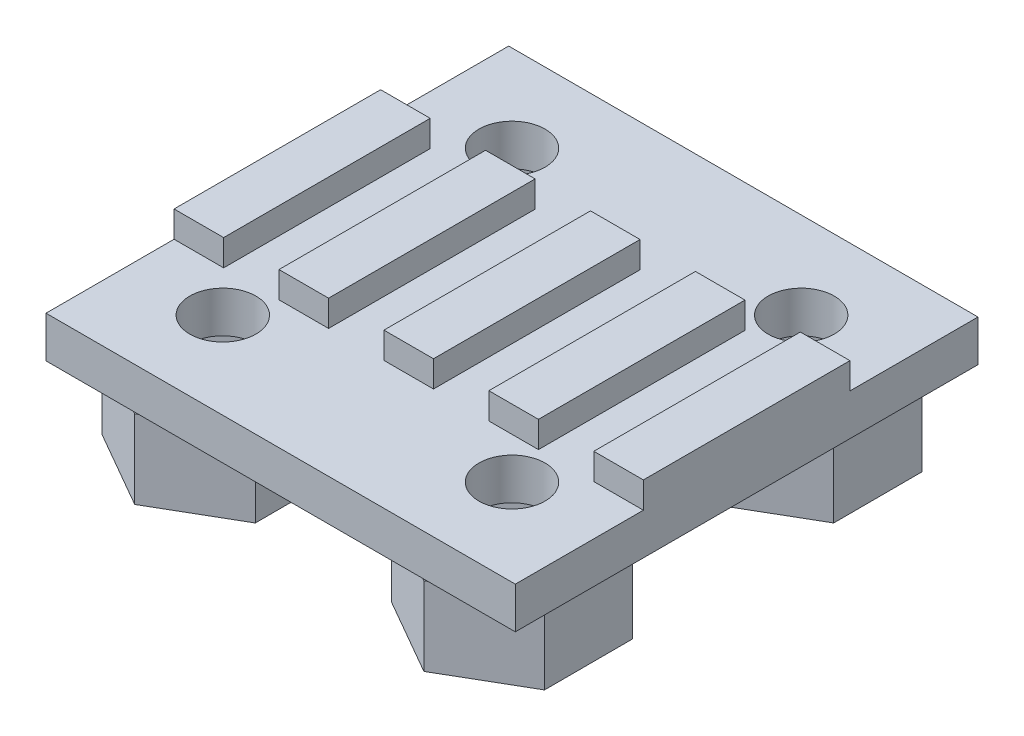
from build123d import *

# Parameters (mm, degrees)
SKETCH_1_W                 = 22.72
SKETCH_1_H                 = 10
EXTRUDE_269_DEPTH          = 2
SKETCH_3_W                 = 2.4
SKETCH_3_H                 = 10
EXTRUDE_2_DEPTH            = 1.27
PATTERN_LINEAR_1_COUNT     = 3
PATTERN_LINEAR_1_PITCH     = 5.08
PATTERN_LINEAR_1_COL_COUNT = 3
PATTERN_LINEAR_1_COL_PITCH = 5.08
EXTRUDE_START              = 5
SKETCH_4_W                 = 22.72
SKETCH_4_H                 = 2
EXTRUDE_3_DEPTH            = 6.2
EXTRUDE_START_2            = -5
SKETCH_4_2_W               = 22.72
SKETCH_4_2_H               = 2
EXTRUDE_4_DEPTH            = 6.2
EXTRUDE_1_DEPTH            = 3.8
HOLE_WIZARD_M3_1_D         = 3.2


with BuildPart() as part:
    # 草图1 → Extrude 269 (new body)
    with BuildSketch(Plane(origin=(0, 0, 0), x_dir=(1, 0, 0), z_dir=(0, 1, 0))):
        Rectangle(SKETCH_1_W, SKETCH_1_H)
    extrude(amount=EXTRUDE_269_DEPTH)

    # 草图3 → 凸台-拉伸2 (add)
    with BuildSketch(Plane(origin=(0, 2, 0), x_dir=(1, 0, 0), z_dir=(0, 1, 0))):
        Rectangle(SKETCH_3_W, SKETCH_3_H)
    extrude_2 = extrude(amount=EXTRUDE_2_DEPTH)

    # 阵列(线性)1: 凸台-拉伸2 ×3
    with Locations(*[(i * PATTERN_LINEAR_1_PITCH, 0, 0) for i in range(1, PATTERN_LINEAR_1_COUNT)]):
        add(extrude_2)

    # 阵列(线性)1 col: 凸台-拉伸2 ×3
    with Locations(*[(-i * PATTERN_LINEAR_1_COL_PITCH, 0, 0) for i in range(1, PATTERN_LINEAR_1_COL_COUNT)]):
        add(extrude_2)

    # 草图4 → 凸台-拉伸3 (add)
    with BuildSketch(Plane.XY.offset(EXTRUDE_START)):
        with Locations((0, 1)):
            Rectangle(SKETCH_4_W, SKETCH_4_H)
    extrude(amount=EXTRUDE_3_DEPTH)

    # 草图4<2> → 凸台-拉伸4 (add)
    with BuildSketch(Plane.XY.offset(EXTRUDE_START_2)):
        with Locations((0, 1)):
            Rectangle(SKETCH_4_2_W, SKETCH_4_2_H)
    extrude(amount=-EXTRUDE_4_DEPTH)

    # 草图5 → 拉伸-薄壁1 (add)
    with BuildSketch(Plane.XZ):
        Polygon((7.007942216, 11.27238461), (3.303977501, 9.143070466), (3.296035285, 4.870685856), (6.992057784, 2.72761539), (10.696022499, 4.856929534), (10.703964715, 9.129314144), align=None)
        Polygon((7.00622498, 10.348625775), (4.103117501, 8.679703878), (4.096892521, 5.331078103), (6.99377502, 3.651374225), (9.896882499, 5.320296122), (9.903107479, 8.668921897), align=None, mode=Mode.SUBTRACT)
    extrude_1 = extrude(amount=EXTRUDE_1_DEPTH)

    # 草图阵列1: 拉伸-薄壁1 at 3 more places
    with Locations((0, 0, -14), (-14, 0, -14), (-14, 0, 0)):
        add(extrude_1)

    # M3 间隙孔1 (through all)
    with Locations(Plane(origin=(0, 2, 0), x_dir=(1, 0, 0), z_dir=(0, 1, 0))):
        with Locations((7, -7)):
            hole_wizard_m3_1 = Hole(HOLE_WIZARD_M3_1_D / 2)

    # 草图阵列2: M3 间隙孔1 at 3 more places
    with Locations((0, 0, -14), (-14, 0, -14), (-14, 0, 0)):
        add(hole_wizard_m3_1, mode=Mode.SUBTRACT)


solid = part.part
